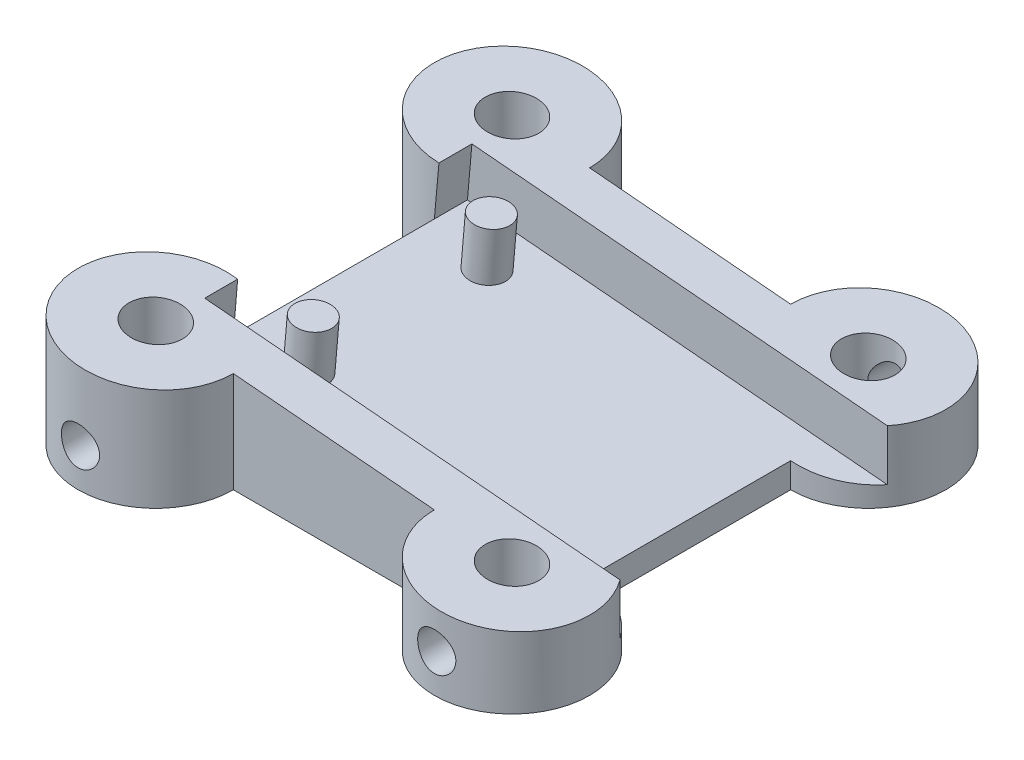
from build123d import *

# Parameters (mm, degrees)
SKETCH1_W           = 28
SKETCH1_H           = 28
BOSS_EXTRUDE1_DEPTH = 8.449682579
CUT_EXTRUDE1_DEPTH  = 41.489469442
SKETCH3_W           = 50
SKETCH3_H           = 21
CUT_EXTRUDE2_DEPTH  = 4
SKETCH11_R          = 1.45
BOSS_EXTRUDE2_DEPTH = 4
SKETCH13_R          = 2.1
CUT_EXTRUDE5_DEPTH  = 41.489469442
BOSS_EXTRUDE3_REACH = 42.489
SKETCH14_R          = 6.1
SKETCH14_R_2        = 2.1
SKETCH15_R          = 1.5
CUT_EXTRUDE6_DEPTH  = 50.054264019
SKETCH16_R          = 1.5
CUT_EXTRUDE7_DEPTH  = 50.054264176
SKETCH18_W          = 30
SKETCH18_H          = 21
CUT_EXTRUDE8_DEPTH  = 4


with BuildPart() as part:
    # Sketch1 → Boss-Extrude1 (new body)
    with BuildSketch(Plane(origin=(0, 0, 0), x_dir=(1, 0, 0), z_dir=(0, 1, 0))):
        with Locations((14, 14)):
            Rectangle(SKETCH1_W, SKETCH1_H)
    extrude(amount=BOSS_EXTRUDE1_DEPTH)

    # Sketch2 → Cut-Extrude1 (cut, through all)
    with BuildSketch(Plane.XY):
        Polygon((0, 8.449682579), (28, 6), (28, 8.449682579), align=None)
    extrude(amount=-CUT_EXTRUDE1_DEPTH, mode=Mode.SUBTRACT)

    # Sketch3 → Cut-Extrude2 (cut)
    with BuildSketch(Plane(origin=(0.733635991, 8.385497746, 0), x_dir=(0.9961946980917455, -0.08715574274765811, 0), z_dir=(0.08715574274765811, 0.9961946980917455, 0))):
        with Locations((24.263561639, 14)):
            Rectangle(SKETCH3_W, SKETCH3_H)
    extrude(amount=-CUT_EXTRUDE2_DEPTH, mode=Mode.SUBTRACT)

    # Sketch11 → Boss-Extrude2 (add)
    with BuildSketch(Plane(origin=(0.38501302, 4.400718954, 0), x_dir=(0.9961946980917457, -0.08715574274765812, 0), z_dir=(0.08715574274765812, 0.9961946980917457, 0))):
        with Locations((4.666994019, 21)):
            Circle(SKETCH11_R)
        with Locations((4.666994019, 7)):
            Circle(SKETCH11_R)
    extrude(amount=BOSS_EXTRUDE2_DEPTH)

    # Sketch13 → Cut-Extrude5 (cut, through all)
    with BuildSketch(Plane.XZ):
        Circle(SKETCH13_R)
        with Locations((28, 0)):
            Circle(SKETCH13_R)
        with Locations((28, -28)):
            Circle(SKETCH13_R)
        with Locations((0, -28)):
            Circle(SKETCH13_R)
    extrude(amount=-CUT_EXTRUDE5_DEPTH, mode=Mode.SUBTRACT)

    # Boss-Extrude3: up to this plane
    boss_extrude3_end = Plane(origin=(0, 8.449682579, -28), z_dir=(-0.08715574274765814, -0.9961946980917457, 0))
    # Sketch14 → Boss-Extrude3 (add, up to the surface)
    with BuildSketch(Plane.XZ, mode=Mode.PRIVATE) as boss_extrude3_sk1:
        Circle(SKETCH14_R)
        with Locations(Location((0, 0, 0), (0, 0, 270))):
            Circle(SKETCH14_R_2, mode=Mode.SUBTRACT)
    boss_extrude3_tool1 = split(extrude(boss_extrude3_sk1.sketch, amount=-BOSS_EXTRUDE3_REACH, mode=Mode.PRIVATE), bisect_by=boss_extrude3_end, keep=Keep.BOTH, mode=Mode.PRIVATE)
    add(boss_extrude3_tool1.solids().sort_by_distance((-5.927466, 0, 0))[0])
    # Sketch14 → Boss-Extrude3 (add, up to the surface)
    with BuildSketch(Plane.XZ, mode=Mode.PRIVATE) as boss_extrude3_sk2:
        with Locations((28, 0)):
            Circle(SKETCH14_R)
        with Locations(Location((28, 0, 0), (0, 0, 270))):
            Circle(SKETCH14_R_2, mode=Mode.SUBTRACT)
    boss_extrude3_tool2 = split(extrude(boss_extrude3_sk2.sketch, amount=-BOSS_EXTRUDE3_REACH, mode=Mode.PRIVATE), bisect_by=boss_extrude3_end, keep=Keep.BOTH, mode=Mode.PRIVATE)
    add(boss_extrude3_tool2.solids().sort_by_distance((22.072534, 0, 0))[0])
    # Sketch14 → Boss-Extrude3 (add, up to the surface)
    with BuildSketch(Plane.XZ, mode=Mode.PRIVATE) as boss_extrude3_sk3:
        with Locations((28, -28)):
            Circle(SKETCH14_R)
        with Locations(Location((28, -28, 0), (0, 0, 270))):
            Circle(SKETCH14_R_2, mode=Mode.SUBTRACT)
    boss_extrude3_tool3 = split(extrude(boss_extrude3_sk3.sketch, amount=-BOSS_EXTRUDE3_REACH, mode=Mode.PRIVATE), bisect_by=boss_extrude3_end, keep=Keep.BOTH, mode=Mode.PRIVATE)
    add(boss_extrude3_tool3.solids().sort_by_distance((22.072534, 0, -28))[0])
    # Sketch14 → Boss-Extrude3 (add, up to the surface)
    with BuildSketch(Plane.XZ, mode=Mode.PRIVATE) as boss_extrude3_sk4:
        with Locations((0, -28)):
            Circle(SKETCH14_R)
        with Locations(Location((0, -28, 0), (0, 0, 270))):
            Circle(SKETCH14_R_2, mode=Mode.SUBTRACT)
    boss_extrude3_tool4 = split(extrude(boss_extrude3_sk4.sketch, amount=-BOSS_EXTRUDE3_REACH, mode=Mode.PRIVATE), bisect_by=boss_extrude3_end, keep=Keep.BOTH, mode=Mode.PRIVATE)
    add(boss_extrude3_tool4.solids().sort_by_distance((-5.927466, 0, -28))[0])

    # Sketch15 → Cut-Extrude6 (cut, through all)
    with BuildSketch(Plane(origin=(0, 0, -28), x_dir=(-1, 0, 0), z_dir=(0, 0, -1))):
        with Locations(Location((-28, 3, 0), (0, 0, 270))):
            Circle(SKETCH15_R)
        with Locations(Location((0, 3, 0), (0, 0, 90))):
            Circle(SKETCH15_R)
    extrude(amount=CUT_EXTRUDE6_DEPTH, mode=Mode.SUBTRACT)

    # Sketch16 → Cut-Extrude7 (cut, through all)
    with BuildSketch(Plane.XY):
        with Locations(Location((0, 3, 0), (0, 0, 90))):
            Circle(SKETCH16_R)
        with Locations(Location((28, 3, 0), (0, 0, 270))):
            Circle(SKETCH16_R)
    extrude(amount=CUT_EXTRUDE7_DEPTH, mode=Mode.SUBTRACT)

    # Sketch18 → Cut-Extrude8 (cut)
    with BuildSketch(Plane(origin=(0.733635991, 8.385497746, 0), x_dir=(0.9961946980917455, -0.08715574274765811, 0), z_dir=(0.08715574274765811, 0.9961946980917455, 0))):
        with BuildLine():
            Line((4.628598594, 24.5), (-0.386483707, 24.5))
            Line((-0.386483707, 24.5), (-0.386483707, 21.9))
            add(Edge.make_bspline(
                [(-0.386483707, 21.9), (2.800183172, 21.9), (4.628598594, 24.5)],
                knots=[4.71238898, 4.71238898, 4.71238898, 5.672083151, 5.672083151, 5.672083151], degree=2, weights=[1, 0.887065525, 1]))
        make_face()
        with Locations((22.355434789, 14)):
            Rectangle(SKETCH18_W, SKETCH18_H)
        with BuildLine():
            Line((-0.386483707, 6.1), (-0.386483707, 3.5))
            Line((-0.386483707, 3.5), (4.628598594, 3.5))
            add(Edge.make_bspline(
                [(4.628598594, 3.5), (2.800183172, 6.1), (-0.386483707, 6.1)],
                knots=[0.611102156, 0.611102156, 0.611102156, 1.570796327, 1.570796327, 1.570796327], degree=2, weights=[1, 0.887065525, 1]))
        make_face()
    extrude(amount=-CUT_EXTRUDE8_DEPTH, mode=Mode.SUBTRACT)


solid = part.part
